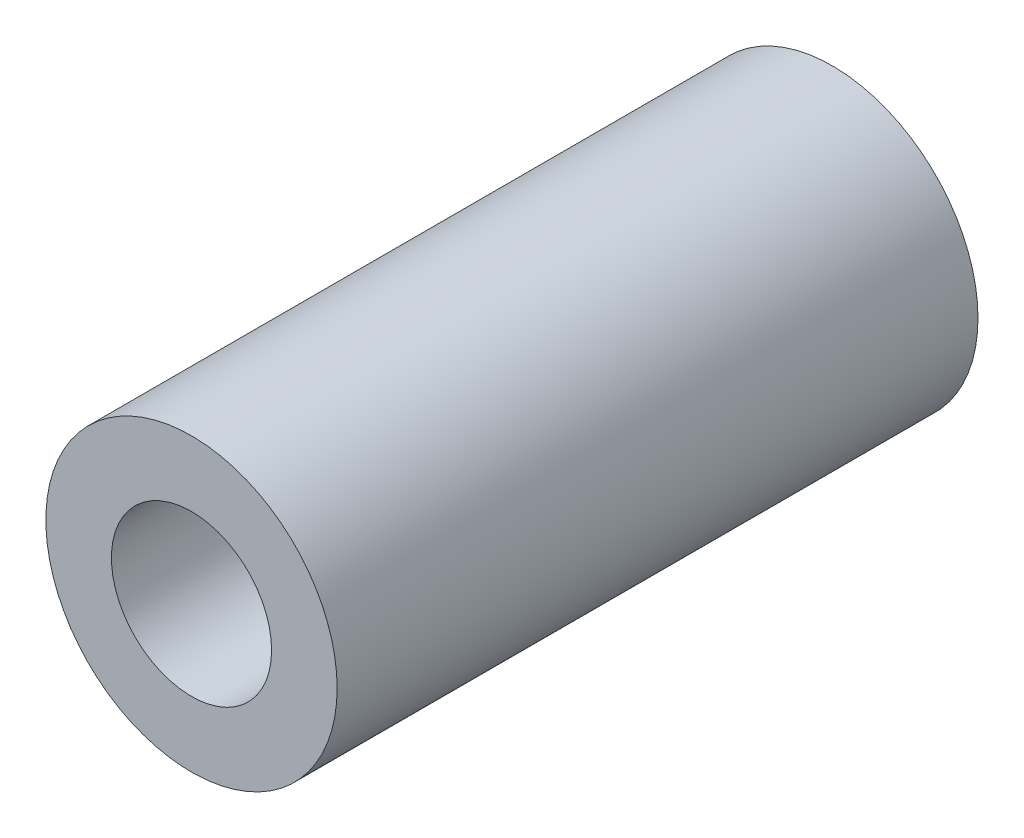
from build123d import *

# Parameters (mm, degrees)
SKETCH1_R           = 5
SKETCH1_R_2         = 2.75
BOSS_EXTRUDE1_DEPTH = 22


with BuildPart() as part:
    # Sketch1 → Boss-Extrude1 (new body)
    with BuildSketch(Plane.XY):
        Circle(SKETCH1_R)
        Circle(SKETCH1_R_2, mode=Mode.SUBTRACT)
    extrude(amount=BOSS_EXTRUDE1_DEPTH)


solid = part.part
